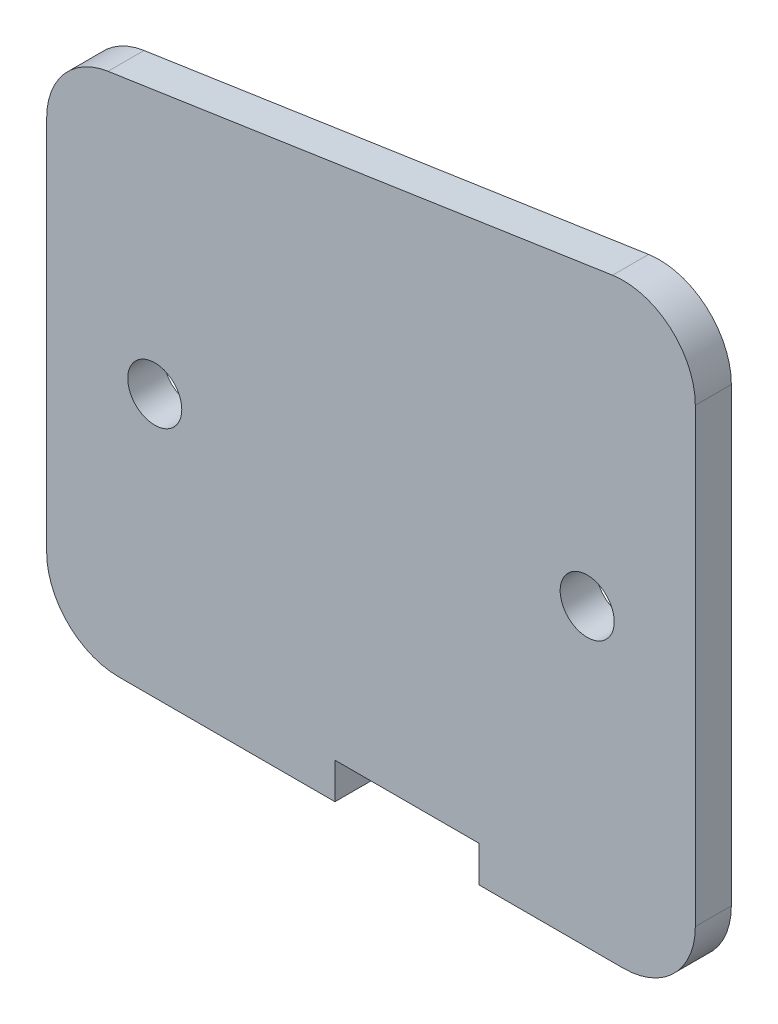
from build123d import *

# Parameters (mm, degrees)
BOSS_EXTRUDE1_DEPTH = 3.175


with BuildPart() as part:
    # Sketch1 → Boss-Extrude1 (new body)
    with BuildSketch(Plane.XY):
        with BuildLine():
            Line((-114.3, 46.355), (-118.416961876, 45.737455719))
            ThreePointArc((-118.416961876, 45.737455719), (-122.286650336, 43.601442621), (-123.825, 39.457709878))
            Line((-123.825, 39.457709878), (-123.825, 6.35))
            ThreePointArc((-123.825, 6.35), (-121.965128061, 1.859871939), (-117.475, 0))
            Line((-117.475, 0), (-114.3, 0))
            Line((-114.3, 0), (-114.3, 20.79625))
            ThreePointArc((-114.3, 20.79625), (-116.68125, 23.1775), (-114.3, 25.55875))
            Line((-114.3, 25.55875), (-114.3, 46.355))
        make_face()
        with BuildLine():
            Line((-76.2, 52.07), (-114.3, 46.355))
            Line((-114.3, 46.355), (-114.3, 25.55875))
            ThreePointArc((-114.3, 25.55875), (-112.616201977, 24.861298023), (-111.91875, 23.1775))
            ThreePointArc((-111.91875, 23.1775), (-112.616201977, 21.493701977), (-114.3, 20.79625))
            Line((-114.3, 20.79625), (-114.3, 0))
            Line((-114.3, 0), (-98.425, 0))
            Line((-98.425, 0), (-98.425, 3.175))
            Line((-98.425, 3.175), (-85.725, 3.175))
            Line((-85.725, 3.175), (-85.725, 0))
            Line((-85.725, 0), (-76.2, 0))
            Line((-76.2, 0), (-76.2, 23.65375))
            ThreePointArc((-76.2, 23.65375), (-78.58125, 26.035), (-76.2, 28.41625))
            Line((-76.2, 28.41625), (-76.2, 52.07))
        make_face()
        with BuildLine():
            Line((-73.966961876, 52.404955719), (-76.2, 52.07))
            Line((-76.2, 52.07), (-76.2, 28.41625))
            ThreePointArc((-76.2, 28.41625), (-74.516201977, 27.718798023), (-73.81875, 26.035))
            ThreePointArc((-73.81875, 26.035), (-74.516201977, 24.351201977), (-76.2, 23.65375))
            Line((-76.2, 23.65375), (-76.2, 0))
            Line((-76.2, 0), (-73.025, 0))
            ThreePointArc((-73.025, 0), (-68.534871939, 1.859871939), (-66.675, 6.35))
            Line((-66.675, 6.35), (-66.675, 46.125209878))
            ThreePointArc((-66.675, 46.125209878), (-68.881267257, 50.936860214), (-73.966961876, 52.404955719))
        make_face()
    extrude(amount=BOSS_EXTRUDE1_DEPTH)


solid = part.part
